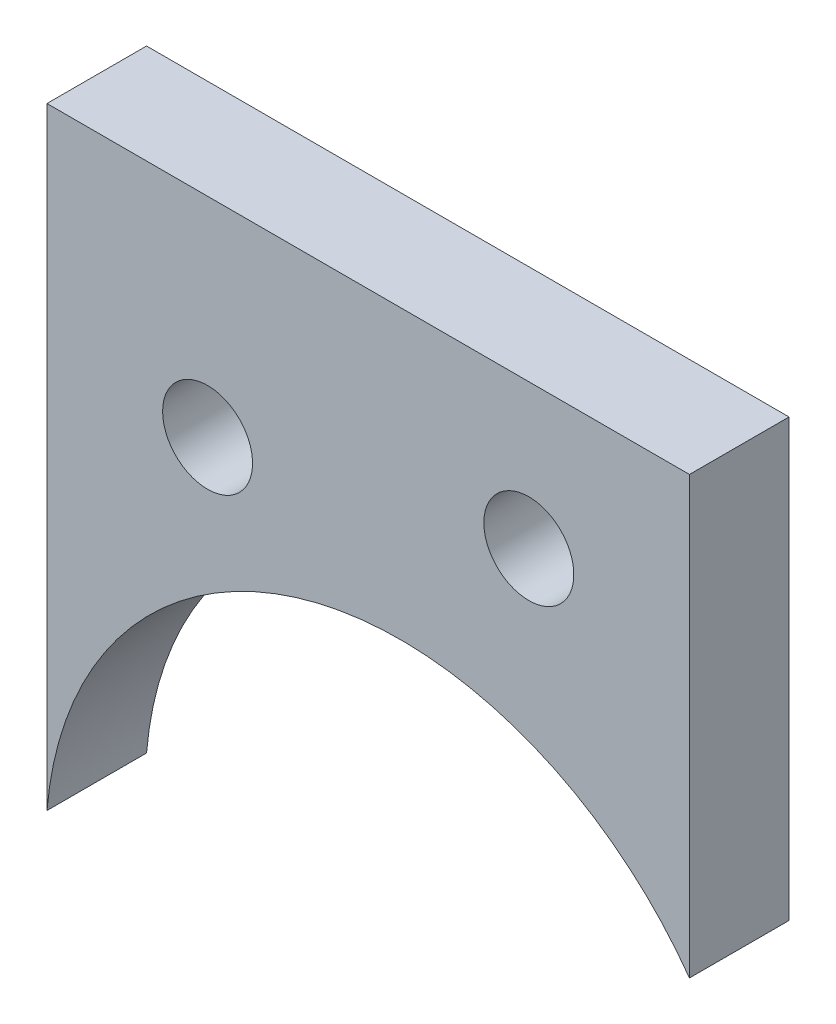
from build123d import *

# Parameters (mm, degrees)
SKETCH1_R           = 1.4
BOSS_EXTRUDE1_DEPTH = 3.1


with BuildPart() as part:
    # Sketch1 → Boss-Extrude1 (new body)
    with BuildSketch(Plane.XY):
        with BuildLine():
            Line((0, 0.939361485), (0, 20))
            Line((0, 20), (20, 20))
            Line((20, 20), (20, 6.425138131))
            ThreePointArc((20, 6.425138131), (8.087067166, 10.656404818), (0, 0.939361485))
        make_face()
        with Locations(Location((5, 13.5, 0), (0, 0, 180))):
            Circle(SKETCH1_R, mode=Mode.SUBTRACT)
        with Locations(Location((15, 15.5, 0), (0, 0, 180))):
            Circle(SKETCH1_R, mode=Mode.SUBTRACT)
    extrude(amount=BOSS_EXTRUDE1_DEPTH)


solid = part.part
